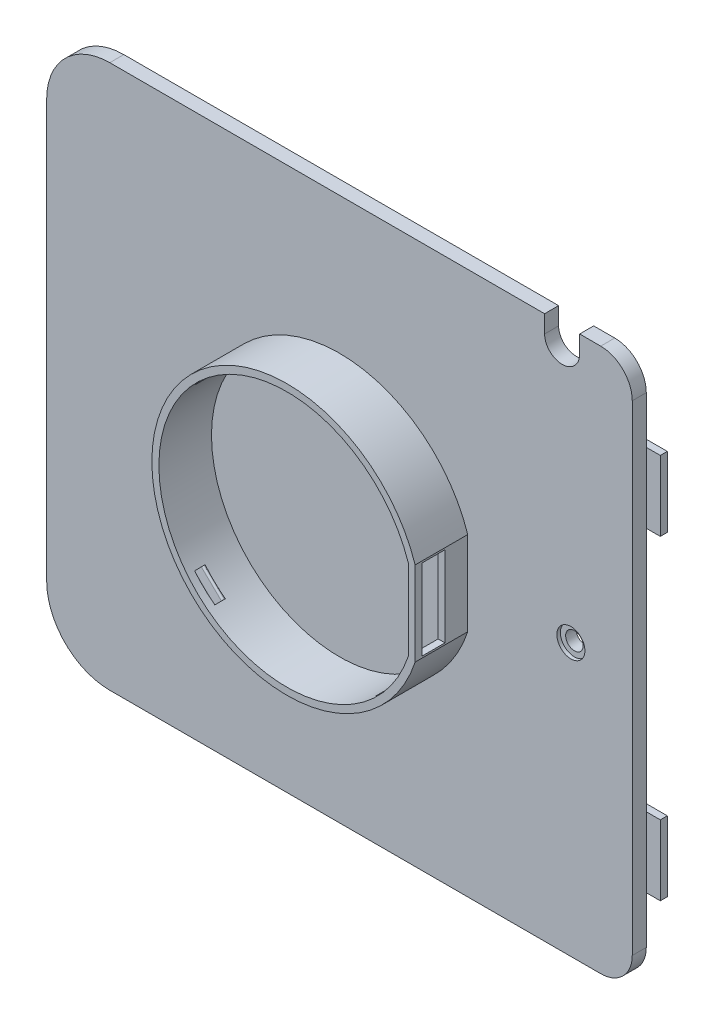
from build123d import *

# Parameters (mm, degrees)
SKETCH_1_W                       = 167
SKETCH_1_H                       = 155
EXTRUDE_1_DEPTH                  = 4
FILLET_1_R                       = 9
FILLET_2_R                       = 18
CUT_EXTRUDE_1_REACH              = 115.993
HOLE_WIZARD_1_D                  = 5
HOLE_WIZARD_1_CBORE_D            = 8
HOLE_WIZARD_1_CBORE_DEPTH        = 1
EXTRUDE_3_DEPTH                  = 15
CUT_EXTRUDE_2_REACH              = 146.177
SKETCH_13_W                      = 6.5
SKETCH_13_H                      = 23
SKETCH_15_W                      = 8
SKETCH_15_H                      = 3
CUT_EXTRUDE_3_DEPTH              = 2.5
FILLET_3_R                       = 0.5
PATTERN_CIRCULAR_1_COUNT         = 4
FILLET_3_OF_PATTERN_CIRCULAR_1_R = 0.5
SKETCH_18_W                      = 10
SKETCH_18_H                      = 20
EXTRUDE_4_DEPTH                  = 2
FILLET_4_R                       = 1
FILLET_4_OF_MIRROR_1_R           = 1


with BuildPart() as part:
    # ｽｹｯﾁ1 → ﾎﾞｽ - 押し出し1 (new body)
    with BuildSketch(Plane.XY):
        Rectangle(SKETCH_1_W, SKETCH_1_H)
    extrude(amount=EXTRUDE_1_DEPTH)

    # ﾌｨﾚｯﾄ1
    fillet_1_edges = [part.edges().sort_by_distance(p)[0] for p in [
        (83.5, -77.5, 2),
        (83.5, 77.5, 2),
    ]]
    fillet(fillet_1_edges, radius=FILLET_1_R)

    # ﾌｨﾚｯﾄ2
    fillet_2_edges = [part.edges().sort_by_distance(p)[0] for p in [
        (-83.5, -77.5, 2),
        (-83.5, 77.5, 2),
    ]]
    fillet(fillet_2_edges, radius=FILLET_2_R)

    # ｽｹｯﾁ2 → ｶｯﾄ - 押し出し1 (cut, up to next)
    with BuildSketch(Plane.XY.offset(4), mode=Mode.PRIVATE) as cut_extrude_1_sk1:
        with BuildLine():
            Line((58.5, 77.5), (68.5, 77.5))
            Line((68.5, 77.5), (68.5, 72.5))
            ThreePointArc((68.5, 72.5), (63.5, 67.5), (58.5, 72.5))
            Line((58.5, 72.5), (58.5, 77.5))
        make_face()
    cut_extrude_1_tool1 = extrude(cut_extrude_1_sk1.sketch, amount=-CUT_EXTRUDE_1_REACH, mode=Mode.PRIVATE) & part.part
    add(cut_extrude_1_tool1.solids().sort_by_distance((63.5, 72.966749, 4))[0], mode=Mode.SUBTRACT)

    # 穴1 (through all)
    with Locations(Plane.XY.offset(4)):
        with Locations((66, 0)):
            CounterBoreHole(HOLE_WIZARD_1_D / 2, HOLE_WIZARD_1_CBORE_D / 2, HOLE_WIZARD_1_CBORE_DEPTH)

    # ｽｹｯﾁ11 → ﾎﾞｽ - 押し出し3 (add)
    with BuildSketch(Plane.XY.offset(4)):
        with BuildLine():
            Line((36.582099448, 12), (36.582099448, -12))
            ThreePointArc((36.582099448, -12), (-38.5, 0), (36.582099448, 12))
        make_face()
        with BuildLine():
            Line((34.641016151, 11.5), (34.641016151, -11.5))
            ThreePointArc((34.641016151, -11.5), (-36.5, 0), (34.641016151, 11.5))
        make_face(mode=Mode.SUBTRACT)
    extrude(amount=EXTRUDE_3_DEPTH)

    # ｽｹｯﾁ13 → ｶｯﾄ - 押し出し2 (cut, up to next)
    with BuildSketch(Plane(origin=(36.582099448, 0, 0), x_dir=(0, 0, -1), z_dir=(1, 0, 0)), mode=Mode.PRIVATE) as cut_extrude_2_sk1:
        with Locations((-13.75, 0)):
            Rectangle(SKETCH_13_W, SKETCH_13_H)
    cut_extrude_2_tool1 = extrude(cut_extrude_2_sk1.sketch, amount=-CUT_EXTRUDE_2_REACH, mode=Mode.PRIVATE) & part.part
    add(cut_extrude_2_tool1.solids().sort_by_distance((36.582099, 0, 13.75))[0], mode=Mode.SUBTRACT)

    # ｽｹｯﾁ15 → ｶｯﾄ - 押し出し3 (cut)
    with BuildSketch(Plane(origin=(-24.72592031, 24.748737342, 1.062480514), x_dir=(0.7076465964640425, 0.7064548659887622, 0.012562517011201728), z_dir=(-0.7064548659887622, 0.7071067811865462, 0.030356586119027387))):
        with Locations((0, -14.290598152)):
            Rectangle(SKETCH_15_W, SKETCH_15_H)
    cut_extrude_3 = extrude(amount=CUT_EXTRUDE_3_DEPTH, mode=Mode.SUBTRACT)

    # ﾌｨﾚｯﾄ3
    fillet_3_edges = [part.edges().sort_by_distance(p)[0] for p in [
        (-26.293687817, 26.037155642, 16.920446126),
        (-26.331375368, 26.1282254, 13.922065571),
    ]]
    fillet(fillet_3_edges, radius=FILLET_3_R)

    # 円形ﾊﾟﾀｰﾝ1: ｶｯﾄ - 押し出し3 ×4 about axis
    pattern_circular_1_axis = Axis((0, 0, 0), (0, 0, 1))
    for i in range(1, PATTERN_CIRCULAR_1_COUNT):
        add(cut_extrude_3.rotate(pattern_circular_1_axis, i * 360 / PATTERN_CIRCULAR_1_COUNT), mode=Mode.SUBTRACT)

    # ﾌｨﾚｯﾄ3 of 円形ﾊﾟﾀｰﾝ1
    fillet_3_of_pattern_circular_1_edges = [part.edges().sort_by_distance(p)[0] for p in [
        (-26.037155642, -26.293687817, 16.920446126),
        (-26.1282254, -26.331375368, 13.922065571),
        (26.293687817, -26.037155642, 16.920446126),
        (26.331375368, -26.1282254, 13.922065571),
        (26.037155642, 26.293687817, 16.920446126),
        (26.1282254, 26.331375368, 13.922065571),
    ]]
    fillet(fillet_3_of_pattern_circular_1_edges, radius=FILLET_3_OF_PATTERN_CIRCULAR_1_R)

    # ｽｹｯﾁ18 → ﾎﾞｽ - 押し出し4 (add)
    with BuildSketch(Plane(origin=(0, 0, 0), x_dir=(-1, 0, 0), z_dir=(0, 0, -1))):
        with Locations((-82.5, 45)):
            Rectangle(SKETCH_18_W, SKETCH_18_H)
    extrude_4 = extrude(amount=EXTRUDE_4_DEPTH)

    # ﾌｨﾚｯﾄ4
    fillet_4_edges = [part.edges().sort_by_distance(p)[0] for p in [
        (77.5, 45, -2),
    ]]
    fillet(fillet_4_edges, radius=FILLET_4_R)

    # ﾐﾗｰ1: ﾎﾞｽ - 押し出し4 across plane
    add(extrude_4.mirror(Plane.ZX))

    # ﾌｨﾚｯﾄ4 of ﾐﾗｰ1
    fillet_4_of_mirror_1_edges = [part.edges().sort_by_distance(p)[0] for p in [
        (77.5, -45, -2),
    ]]
    fillet(fillet_4_of_mirror_1_edges, radius=FILLET_4_OF_MIRROR_1_R)


solid = part.part
